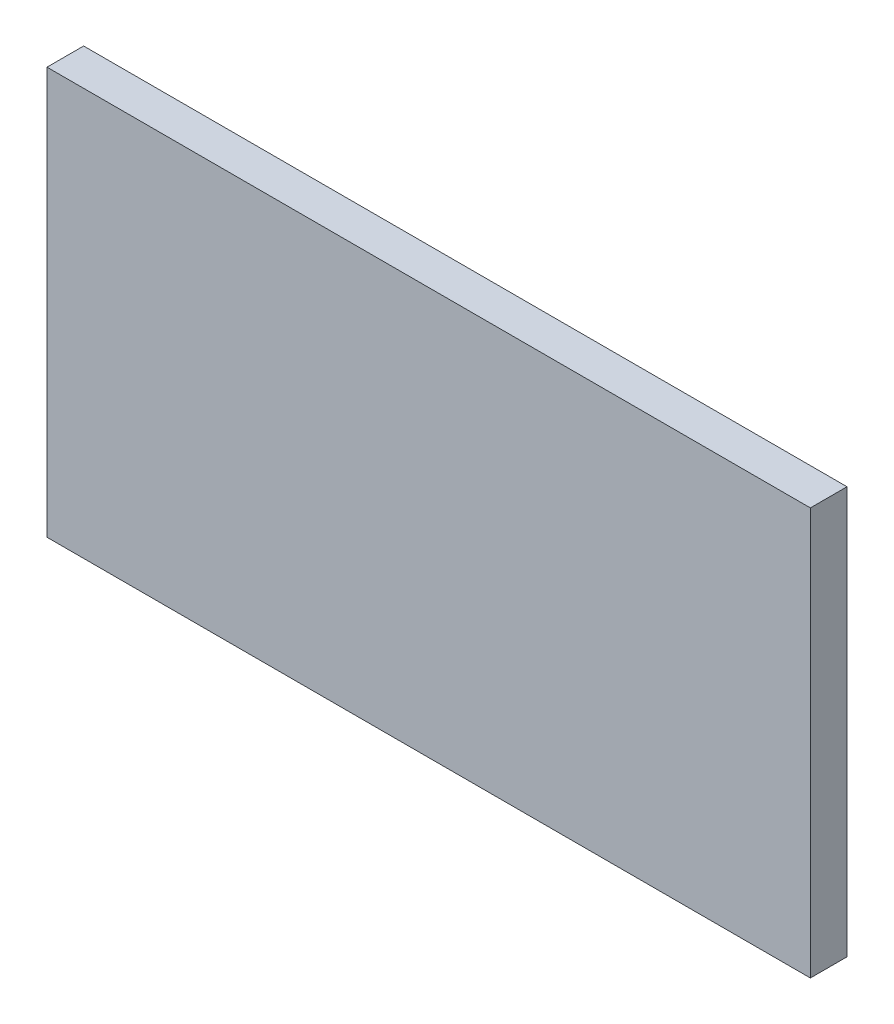
from build123d import *

# Parameters (mm, degrees)
SKPAREDCHICANORTE_W   = 375
SKPAREDCHICANORTE_H   = 18
PAREDCHICANORTE_DEPTH = 200


with BuildPart() as part:
    # SkParedChicaNorte → ParedChicaNorte (new body)
    with BuildSketch(Plane(origin=(0, 50, 0), x_dir=(1, 0, 0), z_dir=(0, 1, 0))):
        with Locations((0, -196.5)):
            Rectangle(SKPAREDCHICANORTE_W, SKPAREDCHICANORTE_H)
    extrude(amount=PAREDCHICANORTE_DEPTH)


solid = part.part
